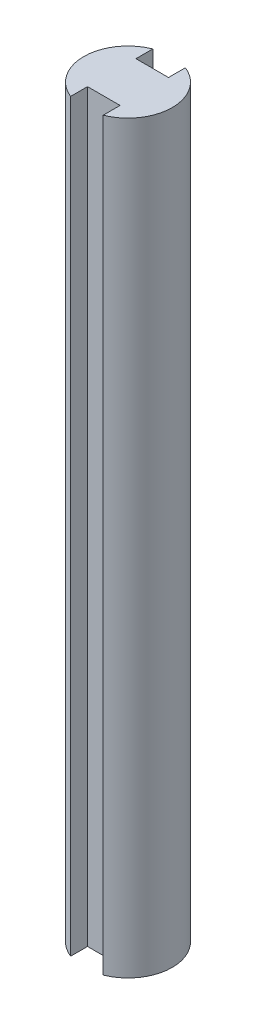
from build123d import *

# Parameters (mm, degrees)
BOSS_EXTRUDE1_DEPTH = 80


with BuildPart() as part:
    # Sketch1 → Boss-Extrude1 (new body)
    with BuildSketch(Plane(origin=(0, 0, 0), x_dir=(1, 0, 0), z_dir=(0, 1, 0))):
        with BuildLine():
            Line((-1.75, 2.6), (-1.75, 4.415880433))
            ThreePointArc((-1.75, 4.415880433), (-4.75, 0), (-1.75, -4.415880433))
            Line((-1.75, -4.415880433), (-1.75, -2.6))
            Line((-1.75, -2.6), (1.75, -2.6))
            Line((1.75, -2.6), (1.75, -4.415880433))
            ThreePointArc((1.75, -4.415880433), (3.929058411, -2.669269563), (4.75, 0))
            ThreePointArc((4.75, 0), (3.929058411, 2.669269563), (1.75, 4.415880433))
            Line((1.75, 4.415880433), (1.75, 2.6))
            Line((1.75, 2.6), (-1.75, 2.6))
        make_face()
    extrude(amount=BOSS_EXTRUDE1_DEPTH)


solid = part.part
